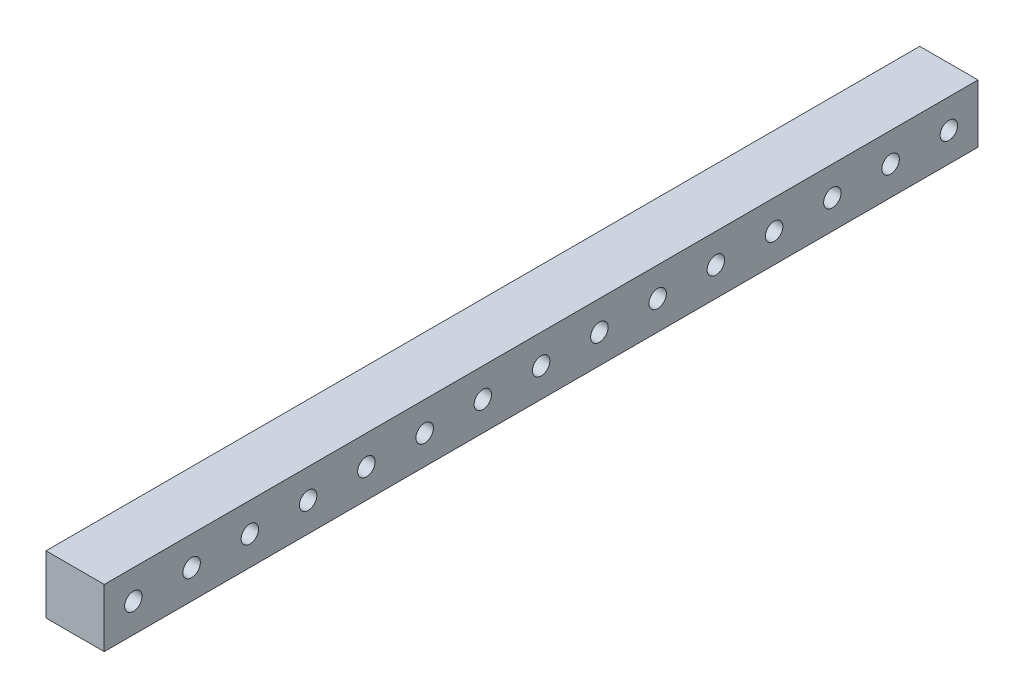
from build123d import *

# Parameters (mm, degrees)
SKETCH1_W             = 20
SKETCH1_H             = 20
BOSS_EXTRUDE1_DEPTH   = 300
F_6_0MM_DOWEL_HOLE1_D = 6
LPATTERN2_COUNT       = 15
LPATTERN2_PITCH       = 20


with BuildPart() as part:
    # Sketch1 → Boss-Extrude1 (new body)
    with BuildSketch(Plane.XY):
        Rectangle(SKETCH1_W, SKETCH1_H)
    extrude(amount=BOSS_EXTRUDE1_DEPTH)

    # Ø6.0mm Dowel Hole1 (through all)
    with Locations(Plane(origin=(10, 0, 0), x_dir=(0, 0, -1), z_dir=(1, 0, 0))):
        with Locations((-10, 0)):
            f_6_0mm_dowel_hole1 = Hole(F_6_0MM_DOWEL_HOLE1_D / 2)

    # LPattern2: Ø6.0mm Dowel Hole1 ×15
    with Locations(*[(0, 0, i * LPATTERN2_PITCH) for i in range(1, LPATTERN2_COUNT)]):
        add(f_6_0mm_dowel_hole1, mode=Mode.SUBTRACT)


solid = part.part
